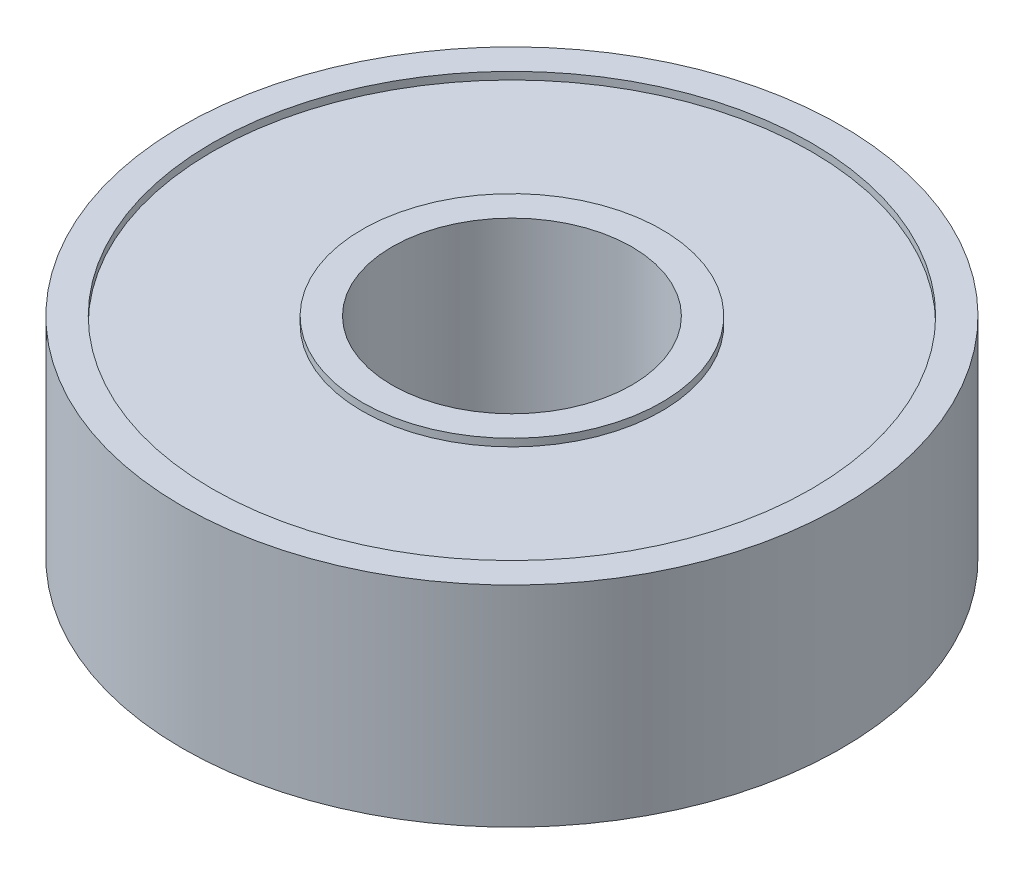
from build123d import *

# Parameters (mm, degrees)
SKETCH1_R           = 11
SKETCH1_R_2         = 4
BOSS_EXTRUDE1_DEPTH = 7
SKETCH2_W           = 5
SKETCH2_H           = 0.25


with BuildPart() as part:
    # Sketch1 → Boss-Extrude1 (new body)
    with BuildSketch(Plane(origin=(0, 0, 0), x_dir=(1, 0, 0), z_dir=(0, 1, 0))):
        with Locations(Location((0, 0, 0), (0, 0, 270))):
            Circle(SKETCH1_R)
        with Locations(Location((0, 0, 0), (0, 0, 270))):
            Circle(SKETCH1_R_2, mode=Mode.SUBTRACT)
    extrude(amount=BOSS_EXTRUDE1_DEPTH)

    # Sketch2 → Cut-Revolve1 (revolve, cut)
    with BuildSketch(Plane.XY, mode=Mode.PRIVATE) as cut_revolve1_sk:
        with Locations((-7.5, 6.875)):
            Rectangle(SKETCH2_W, SKETCH2_H)
        with Locations((-7.5, 0.125)):
            Rectangle(SKETCH2_W, SKETCH2_H)
    revolve(cut_revolve1_sk.sketch.rotate(Axis((0, 7, 0), (0, -1, 0)), 270), axis=Axis((0, 7, 0), (0, -1, 0)), mode=Mode.SUBTRACT)


solid = part.part
